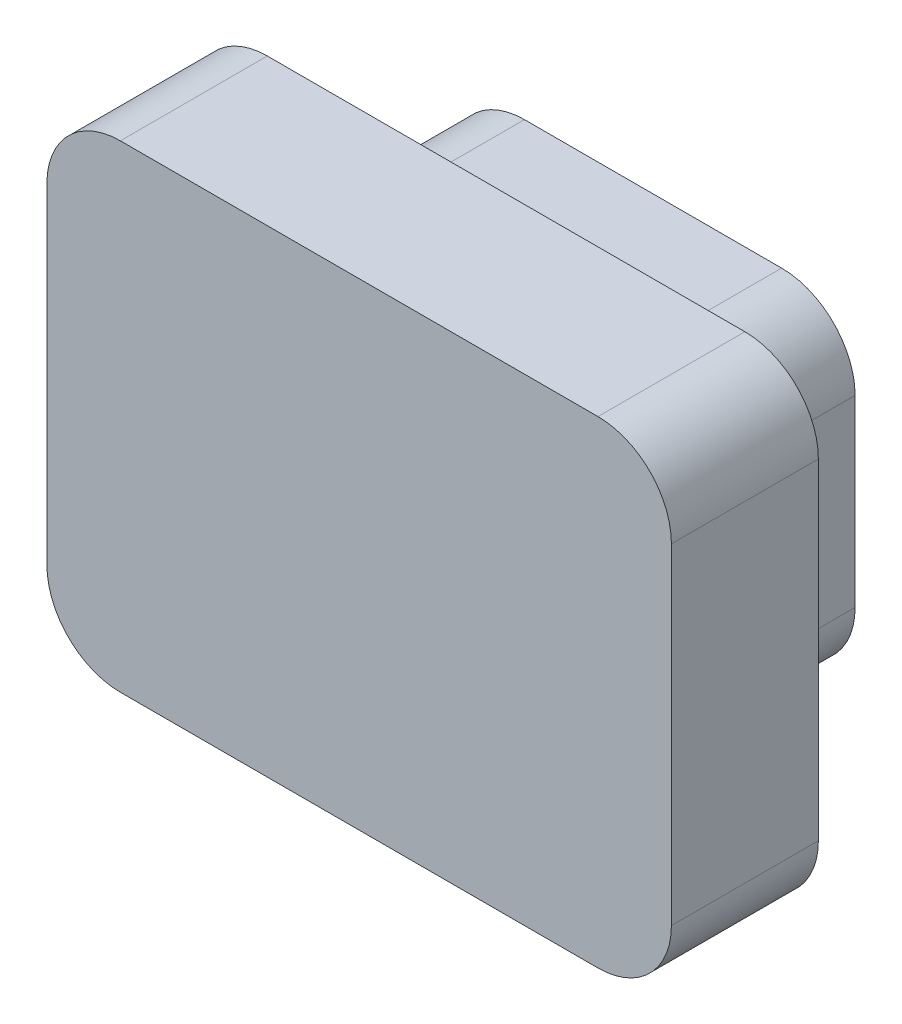
from build123d import *

# Parameters (mm, degrees)
EXTRUDE_1_DEPTH = 2
EXTRUDE_2_DEPTH = 2


with BuildPart() as part:
    # Эскиз1 → Бобышка-Вытянуть1 (new body)
    with BuildSketch(Plane.XY):
        with BuildLine():
            Line((-1.75, -2.25), (1.75, -2.25))
            ThreePointArc((1.75, -2.25), (2.457106781, -1.957106781), (2.75, -1.25))
            Line((2.75, -1.25), (2.75, 1.25))
            ThreePointArc((2.75, 1.25), (2.457106781, 1.957106781), (1.75, 2.25))
            Line((1.75, 2.25), (-1.75, 2.25))
            ThreePointArc((-1.75, 2.25), (-2.457106781, 1.957106781), (-2.75, 1.25))
            Line((-2.75, 1.25), (-2.75, -1.25))
            ThreePointArc((-2.75, -1.25), (-2.457106781, -1.957106781), (-1.75, -2.25))
        make_face()
    extrude(amount=EXTRUDE_1_DEPTH)

    # Эскиз2 → Бобышка-Вытянуть2 (add)
    with BuildSketch(Plane.XY.offset(2)):
        with BuildLine():
            Line((-3.25, -3.25), (3.25, -3.25))
            ThreePointArc((3.25, -3.25), (3.957106781, -2.957106781), (4.25, -2.25))
            Line((4.25, -2.25), (4.25, 2.25))
            ThreePointArc((4.25, 2.25), (3.957106781, 2.957106781), (3.25, 3.25))
            Line((3.25, 3.25), (-3.25, 3.25))
            ThreePointArc((-3.25, 3.25), (-3.957106781, 2.957106781), (-4.25, 2.25))
            Line((-4.25, 2.25), (-4.25, -2.25))
            ThreePointArc((-4.25, -2.25), (-3.957106781, -2.957106781), (-3.25, -3.25))
        make_face()
    extrude(amount=EXTRUDE_2_DEPTH)


solid = part.part
